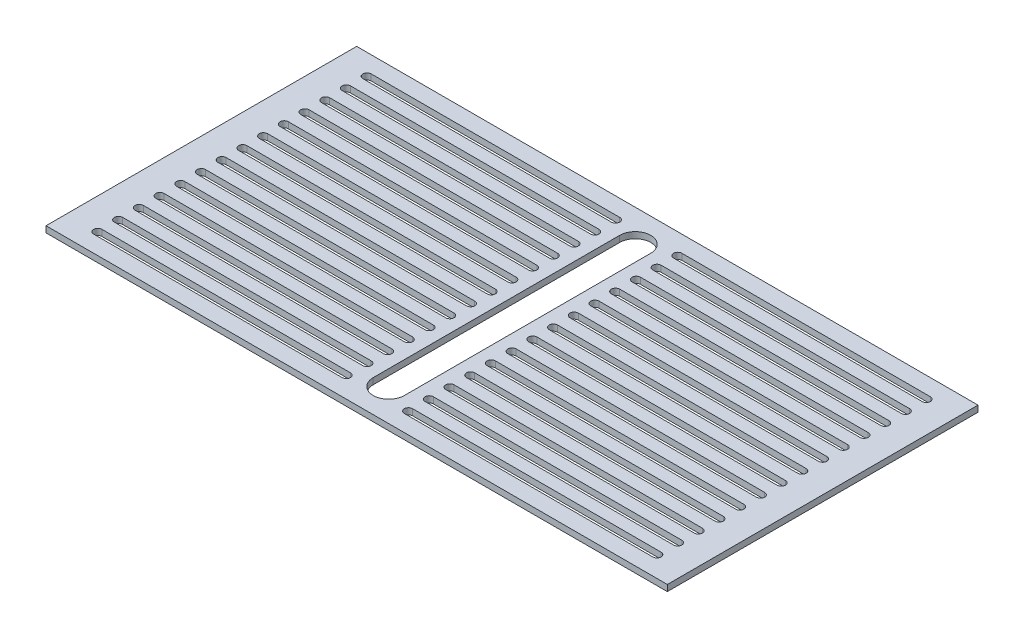
from build123d import *

# Parameters (mm, degrees)
SKETCH1_W           = 300
SKETCH1_H           = 150
BOSS_EXTRUDE1_DEPTH = 3
CUT_EXTRUDE1_DEPTH  = 3


with BuildPart() as part:
    # Sketch1 → Boss-Extrude1 (new body)
    with BuildSketch(Plane(origin=(0, 0, 0), x_dir=(1, 0, 0), z_dir=(0, 1, 0))):
        Rectangle(SKETCH1_W, SKETCH1_H)
    extrude(amount=BOSS_EXTRUDE1_DEPTH)

    # Sketch2 → Cut-Extrude1 (cut)
    with BuildSketch(Plane(origin=(0, 3, 0), x_dir=(1, 0, 0), z_dir=(0, 1, 0))):
        with BuildLine():
            Line((-135, 67), (-15, 67))
            ThreePointArc((-15, 67), (-13, 65), (-15, 63))
            Line((-15, 63), (-135, 63))
            ThreePointArc((-135, 63), (-137, 65), (-135, 67))
        make_face()
        with BuildLine():
            Line((15, 67), (135, 67))
            ThreePointArc((135, 67), (137, 65), (135, 63))
            Line((135, 63), (15, 63))
            ThreePointArc((15, 63), (13, 65), (15, 67))
        make_face()
        with BuildLine():
            Line((15, 57), (135, 57))
            ThreePointArc((135, 57), (137, 55), (135, 53))
            Line((135, 53), (15, 53))
            ThreePointArc((15, 53), (13, 55), (15, 57))
        make_face()
        with BuildLine():
            Line((15, 47), (135, 47))
            ThreePointArc((135, 47), (137, 45), (135, 43))
            Line((135, 43), (15, 43))
            ThreePointArc((15, 43), (13, 45), (15, 47))
        make_face()
        with BuildLine():
            Line((15, 37), (135, 37))
            ThreePointArc((135, 37), (137, 35), (135, 33))
            Line((135, 33), (15, 33))
            ThreePointArc((15, 33), (13, 35), (15, 37))
        make_face()
        with BuildLine():
            Line((15, 27), (135, 27))
            ThreePointArc((135, 27), (137, 25), (135, 23))
            Line((135, 23), (15, 23))
            ThreePointArc((15, 23), (13, 25), (15, 27))
        make_face()
        with BuildLine():
            Line((15, 17), (135, 17))
            ThreePointArc((135, 17), (137, 15), (135, 13))
            Line((135, 13), (15, 13))
            ThreePointArc((15, 13), (13, 15), (15, 17))
        make_face()
        with BuildLine():
            Line((15, 7), (135, 7))
            ThreePointArc((135, 7), (137, 5), (135, 3))
            Line((135, 3), (15, 3))
            ThreePointArc((15, 3), (13, 5), (15, 7))
        make_face()
        with BuildLine():
            Line((15, -3), (135, -3))
            ThreePointArc((135, -3), (137, -5), (135, -7))
            Line((135, -7), (15, -7))
            ThreePointArc((15, -7), (13, -5), (15, -3))
        make_face()
        with BuildLine():
            Line((15, -13), (135, -13))
            ThreePointArc((135, -13), (137, -15), (135, -17))
            Line((135, -17), (15, -17))
            ThreePointArc((15, -17), (13, -15), (15, -13))
        make_face()
        with BuildLine():
            Line((15, -23), (135, -23))
            ThreePointArc((135, -23), (137, -25), (135, -27))
            Line((135, -27), (15, -27))
            ThreePointArc((15, -27), (13, -25), (15, -23))
        make_face()
        with BuildLine():
            Line((15, -33), (135, -33))
            ThreePointArc((135, -33), (137, -35), (135, -37))
            Line((135, -37), (15, -37))
            ThreePointArc((15, -37), (13, -35), (15, -33))
        make_face()
        with BuildLine():
            Line((15, -43), (135, -43))
            ThreePointArc((135, -43), (137, -45), (135, -47))
            Line((135, -47), (15, -47))
            ThreePointArc((15, -47), (13, -45), (15, -43))
        make_face()
        with BuildLine():
            Line((15, -53), (135, -53))
            ThreePointArc((135, -53), (137, -55), (135, -57))
            Line((135, -57), (15, -57))
            ThreePointArc((15, -57), (13, -55), (15, -53))
        make_face()
        with BuildLine():
            Line((15, -63), (135, -63))
            ThreePointArc((135, -63), (137, -65), (135, -67))
            Line((135, -67), (15, -67))
            ThreePointArc((15, -67), (13, -65), (15, -63))
        make_face()
        with BuildLine():
            Line((-135, 57), (-15, 57))
            ThreePointArc((-15, 57), (-13, 55), (-15, 53))
            Line((-15, 53), (-135, 53))
            ThreePointArc((-135, 53), (-137, 55), (-135, 57))
        make_face()
        with BuildLine():
            Line((-135, 47), (-15, 47))
            ThreePointArc((-15, 47), (-13, 45), (-15, 43))
            Line((-15, 43), (-135, 43))
            ThreePointArc((-135, 43), (-137, 45), (-135, 47))
        make_face()
        with BuildLine():
            Line((-135, 37), (-15, 37))
            ThreePointArc((-15, 37), (-13, 35), (-15, 33))
            Line((-15, 33), (-135, 33))
            ThreePointArc((-135, 33), (-137, 35), (-135, 37))
        make_face()
        with BuildLine():
            Line((-135, 27), (-15, 27))
            ThreePointArc((-15, 27), (-13, 25), (-15, 23))
            Line((-15, 23), (-135, 23))
            ThreePointArc((-135, 23), (-137, 25), (-135, 27))
        make_face()
        with BuildLine():
            Line((-135, 17), (-15, 17))
            ThreePointArc((-15, 17), (-13, 15), (-15, 13))
            Line((-15, 13), (-135, 13))
            ThreePointArc((-135, 13), (-137, 15), (-135, 17))
        make_face()
        with BuildLine():
            Line((-135, 7), (-15, 7))
            ThreePointArc((-15, 7), (-13, 5), (-15, 3))
            Line((-15, 3), (-135, 3))
            ThreePointArc((-135, 3), (-137, 5), (-135, 7))
        make_face()
        with BuildLine():
            Line((-135, -3), (-15, -3))
            ThreePointArc((-15, -3), (-13, -5), (-15, -7))
            Line((-15, -7), (-135, -7))
            ThreePointArc((-135, -7), (-137, -5), (-135, -3))
        make_face()
        with BuildLine():
            Line((-135, -13), (-15, -13))
            ThreePointArc((-15, -13), (-13, -15), (-15, -17))
            Line((-15, -17), (-135, -17))
            ThreePointArc((-135, -17), (-137, -15), (-135, -13))
        make_face()
        with BuildLine():
            Line((-135, -23), (-15, -23))
            ThreePointArc((-15, -23), (-13, -25), (-15, -27))
            Line((-15, -27), (-135, -27))
            ThreePointArc((-135, -27), (-137, -25), (-135, -23))
        make_face()
        with BuildLine():
            Line((-135, -33), (-15, -33))
            ThreePointArc((-15, -33), (-13, -35), (-15, -37))
            Line((-15, -37), (-135, -37))
            ThreePointArc((-135, -37), (-137, -35), (-135, -33))
        make_face()
        with BuildLine():
            Line((-135, -43), (-15, -43))
            ThreePointArc((-15, -43), (-13, -45), (-15, -47))
            Line((-15, -47), (-135, -47))
            ThreePointArc((-135, -47), (-137, -45), (-135, -43))
        make_face()
        with BuildLine():
            Line((-135, -53), (-15, -53))
            ThreePointArc((-15, -53), (-13, -55), (-15, -57))
            Line((-15, -57), (-135, -57))
            ThreePointArc((-135, -57), (-137, -55), (-135, -53))
        make_face()
        with BuildLine():
            Line((-135, -63), (-15, -63))
            ThreePointArc((-15, -63), (-13, -65), (-15, -67))
            Line((-15, -67), (-135, -67))
            ThreePointArc((-135, -67), (-137, -65), (-135, -63))
        make_face()
        with BuildLine():
            Line((-7.5, -59.5), (-7.5, 59.5))
            ThreePointArc((-7.5, 59.5), (0, 67), (7.5, 59.5))
            Line((7.5, 59.5), (7.5, -59.5))
            ThreePointArc((7.5, -59.5), (0, -67), (-7.5, -59.5))
        make_face()
    extrude(amount=-CUT_EXTRUDE1_DEPTH, mode=Mode.SUBTRACT)


solid = part.part
